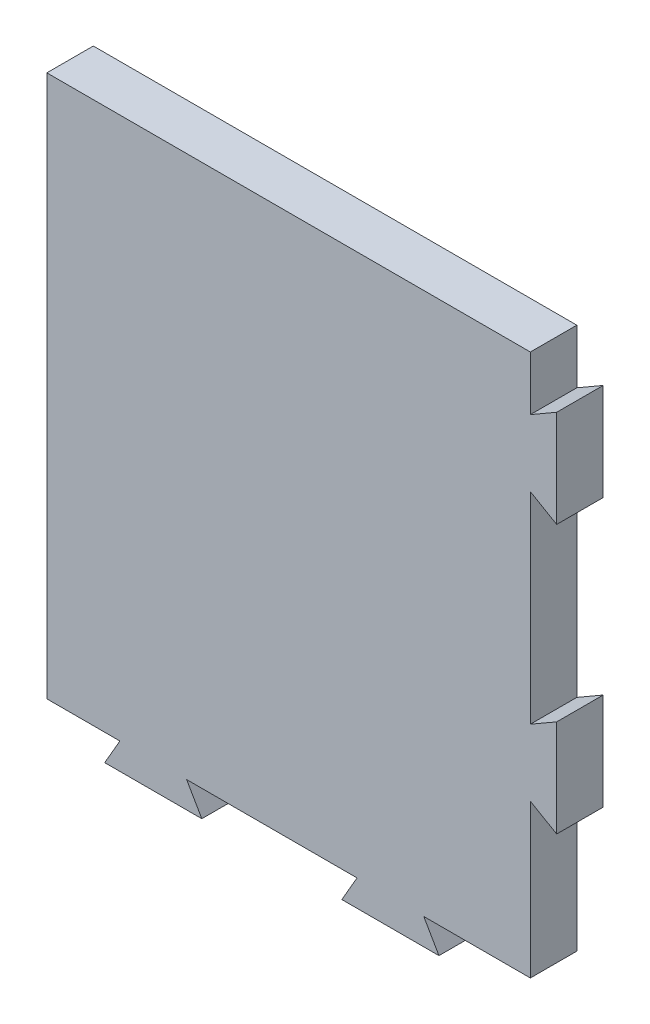
from build123d import *

# Parameters (mm, degrees)
CROQUIS3_W              = 31.215869756
CROQUIS3_H              = 35
SALIENTE_EXTRUIR3_DEPTH = 1.5


with BuildPart() as part:
    # Croquis3 → Saliente-Extruir3 (new, symmetric)
    with BuildSketch(Plane.XY):
        with Locations((-2.607934878, 2)):
            Rectangle(CROQUIS3_W, CROQUIS3_H)
        Polygon((-13.4988893, -15.5), (-13.58549184, -15.65), (-14.480384758, -17.2), (-8.210214166, -17.2), (-9.105107083, -15.65), (-9.191709623, -15.5), align=None)
        Polygon((6.117691454, -15.5), (1.810511777, -15.5), (1.723909236, -15.65), (0.829016319, -17.2), (7.099186911, -17.2), (6.204293994, -15.65), align=None)
        Polygon((13.15, 16.08549184), (13, 15.9988893), (13, 11.691709623), (13.15, 11.605107083), (14.7, 10.710214166), (14.7, 16.980384758), align=None)
        Polygon((13, -1.310511777), (13, -5.617691454), (13.15, -5.704293994), (14.7, -6.599186911), (14.7, -0.329016319), (13.15, -1.223909236), align=None)
    extrude(amount=SALIENTE_EXTRUIR3_DEPTH, both=True)


solid = part.part
